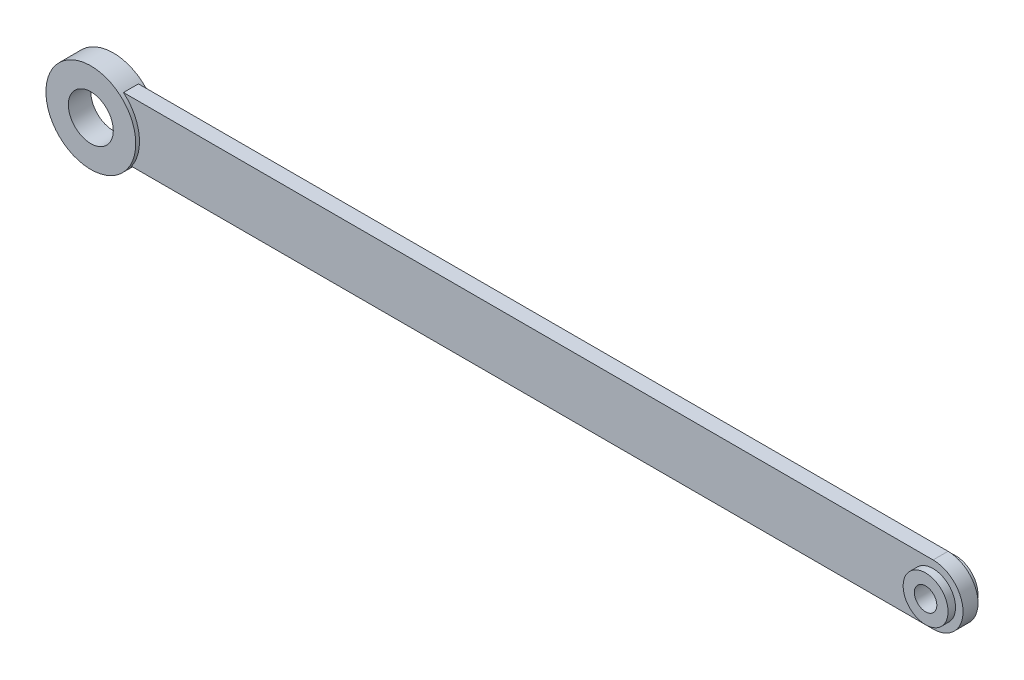
from build123d import *

# Parameters (mm, degrees)
SKETCH2_R                = 6000
SKETCH2_R_2              = 3000
BOSS_EXTRUDE1_DEPTH      = 3000
BOSS_EXTRUDE2_DEPTH      = 1000
BOSS_EXTRUDE2_DEPTH_BACK = 1000
BOSS_EXTRUDE3_DEPTH      = 1000
BOSS_EXTRUDE3_DEPTH_BACK = 3000
SKETCH4_R                = 3000
SKETCH5_R                = 1500
CUT_EXTRUDE1_DEPTH       = 5000
SCALE1_SCALE             = 0.001


with BuildPart() as part:
    # Sketch2 → Boss-Extrude1 (new body)
    with BuildSketch(Plane.XY):
        Circle(SKETCH2_R)
        Circle(SKETCH2_R_2, mode=Mode.SUBTRACT)
    extrude(amount=BOSS_EXTRUDE1_DEPTH)

    # Sketch3 → Boss-Extrude2 (add, two sides: drawn at the far end of the back side and taken through both)
    with BuildSketch(Plane.XY.offset(1500).offset(-BOSS_EXTRUDE2_DEPTH_BACK)):
        with BuildLine():
            Line((1140.414956358, 4594.307428083), (112000, 4594.307428083))
            ThreePointArc((112000, 4594.307428083), (116000, 594.307428083), (112000, -3405.692571917))
            Line((112000, -3405.692571917), (3287.775102105, -3405.692571917))
            ThreePointArc((3287.775102105, -3405.692571917), (4571.894224331, 1227.187930987), (1140.414956358, 4594.307428083))
        make_face()
    extrude(amount=BOSS_EXTRUDE2_DEPTH + BOSS_EXTRUDE2_DEPTH_BACK)

    # Sketch4 → Boss-Extrude3 (add, two sides: drawn at the far end of the back side and taken through both)
    with BuildSketch(Plane(origin=(0, 0, 500), x_dir=(-1, 0, 0), z_dir=(0, 0, -1)).offset(-BOSS_EXTRUDE3_DEPTH_BACK)):
        with Locations((-112000, 594.307428083)):
            Circle(SKETCH4_R)
    extrude(amount=BOSS_EXTRUDE3_DEPTH + BOSS_EXTRUDE3_DEPTH_BACK)

    # Sketch5 → Cut-Extrude1 (cut)
    with BuildSketch(Plane(origin=(0, 0, -500), x_dir=(-1, 0, 0), z_dir=(0, 0, -1))):
        with Locations((-112000, 594.307428083)):
            Circle(SKETCH5_R)
    extrude(amount=-CUT_EXTRUDE1_DEPTH, mode=Mode.SUBTRACT)


with BuildPart() as part_1:
    # Scale1: scaled about (53497.162872558, 525.016851584, 1500)
    add(part.part.scale(SCALE1_SCALE).moved(Location((53443.665709685, 524.491834732, 1498.5))))


solid = part_1.part
